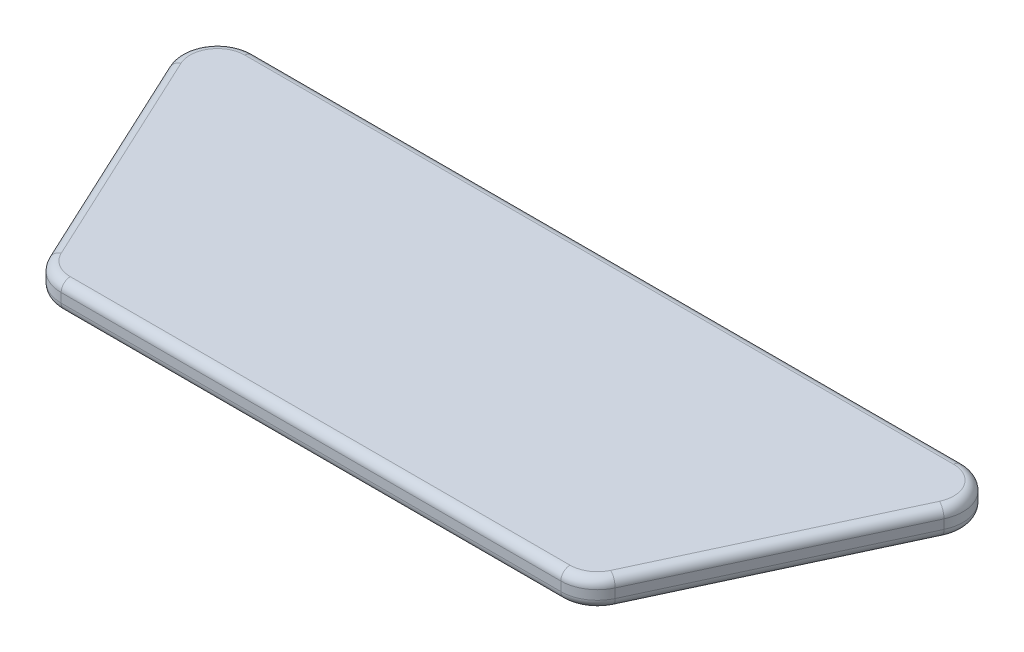
from build123d import *

# Parameters (mm, degrees)
BOSS_EXTRUDE1_DEPTH = 7.62
FILLET1_R           = 2.54
SCALE1_SCALE        = 1.5


with BuildPart() as part:
    # Sketch1 → Boss-Extrude1 (new body)
    with BuildSketch(Plane(origin=(0, 0, 0), x_dir=(1, 0, 0), z_dir=(0, 1, 0))):
        with BuildLine():
            Line((15.948005464, 0), (212.651994536, 0))
            ThreePointArc((212.651994536, 0), (221.220851626, -4.701035979), (221.860081653, -14.453801539))
            Line((221.860081653, -14.453801539), (192.841756086, -76.683801539))
            ThreePointArc((192.841756086, -76.683801539), (189.09263299, -80.958857089), (183.63366897, -82.55))
            Line((183.63366897, -82.55), (44.96633103, -82.55))
            ThreePointArc((44.96633103, -82.55), (39.50736701, -80.958857089), (35.758243914, -76.683801539))
            Line((35.758243914, -76.683801539), (6.739918347, -14.453801539))
            ThreePointArc((6.739918347, -14.453801539), (7.379148374, -4.701035979), (15.948005464, 0))
        make_face()
    extrude(amount=BOSS_EXTRUDE1_DEPTH)

    # Fillet1
    fillet1_edges = [part.edges().sort_by_distance(p)[0] for p in [
        (7.379148374, 7.62, 4.701035979),
        (114.3, 0, 0),
        (221.220851626, 0, 4.701035979),
        (21.249081131, 7.62, 45.568801539),
        (39.50736701, 7.62, 80.958857089),
        (114.3, 7.62, 82.55),
        (189.09263299, 7.62, 80.958857089),
        (207.350918869, 7.62, 45.568801539),
        (221.220851626, 7.62, 4.701035979),
        (114.3, 7.62, 0),
        (207.350918869, 0, 45.568801539),
        (189.09263299, 0, 80.958857089),
        (114.3, 0, 82.55),
        (39.50736701, 0, 80.958857089),
        (21.249081131, 0, 45.568801539),
        (7.379148374, 0, 4.701035979),
    ]]
    fillet(fillet1_edges, radius=FILLET1_R)


with BuildPart() as part_1:
    # Scale1: scaled about (114.3, 3.81, 38.735119428)
    add(part.part.scale(SCALE1_SCALE).moved(Location((-57.15, -1.905, -19.367559714))))


solid = part_1.part
